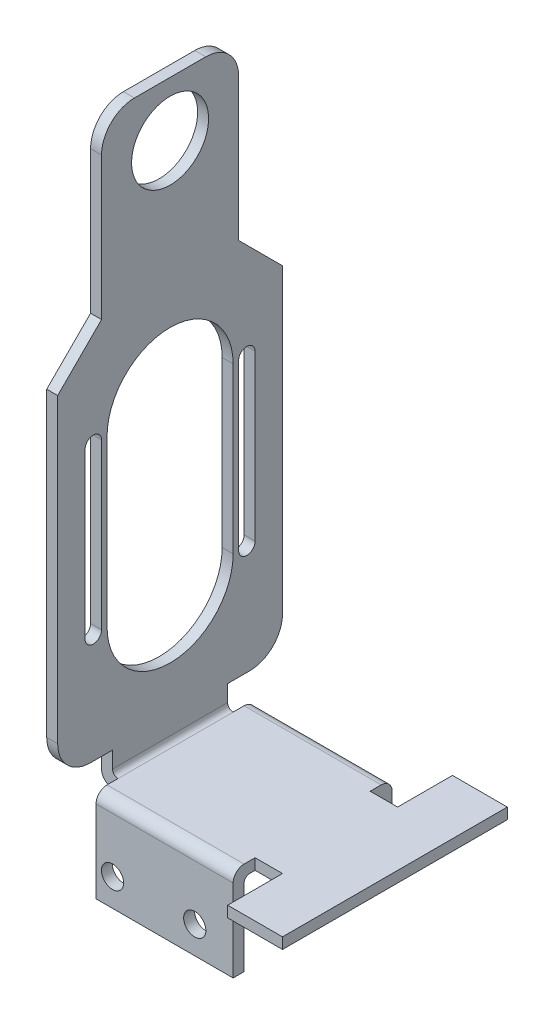
from build123d import *

# Parameters (mm, degrees)
SKETCH1_W                = 25
SKETCH1_H                = 25
BOSS_EXTRUDE1_DEPTH      = 2
BOSS_EXTRUDE2_DEPTH      = 15
BOSS_EXTRUDE2_DEPTH_BACK = 2
SKETCH2_W                = 25
SKETCH2_H                = 2
SKETCH3_R                = 2.025
CUT_EXTRUDE1_DEPTH       = 35.960692213
FILLET1_R                = 2
FILLET2_R                = 1
SKETCH4_W                = 21
SKETCH4_H                = 2
BOSS_EXTRUDE3_DEPTH      = 3
SKETCH5_W                = 21
SKETCH5_H                = 2
BOSS_EXTRUDE4_DEPTH      = 15
BOSS_EXTRUDE5_DEPTH      = 15
BOSS_EXTRUDE5_DEPTH_BACK = 36
SKETCH6_W                = 10
SKETCH6_H                = 2
SKETCH7_W                = 2
SKETCH7_H                = 41
BOSS_EXTRUDE6_DEPTH      = 105
SKETCH8_W                = 10
SKETCH8_H                = 4
CUT_EXTRUDE2_DEPTH       = 118.389309564
FILLET3_R                = 1
FILLET4_R                = 2
CUT_EXTRUDE3_DEPTH       = 119.102709537
SKETCH12_R               = 7.025
CUT_EXTRUDE4_DEPTH       = 119.102709537
CUT_EXTRUDE5_DEPTH       = 119.102709537
FILLET7_R                = 6
FILLET8_R                = 6
SKETCH14_W               = 10
SKETCH14_H               = 5
CUT_EXTRUDE6_DEPTH       = 112.496636721


with BuildPart() as part:
    # Sketch1 → Boss-Extrude1 (new body)
    with BuildSketch(Plane(origin=(0, 0, 0), x_dir=(1, 0, 0), z_dir=(0, 1, 0))):
        Rectangle(SKETCH1_W, SKETCH1_H)
    extrude(amount=BOSS_EXTRUDE1_DEPTH)

    # Sketch2 → Boss-Extrude2 (add, two sides: drawn at the far end of the back side and taken through both)
    with BuildSketch(Plane.XZ.offset(-BOSS_EXTRUDE2_DEPTH_BACK)):
        with Locations((0, 13.5)):
            Rectangle(SKETCH2_W, SKETCH2_H)
        with Locations((0, -13.5)):
            Rectangle(SKETCH2_W, SKETCH2_H)
    extrude(amount=BOSS_EXTRUDE2_DEPTH + BOSS_EXTRUDE2_DEPTH_BACK)

    # Sketch3 → Cut-Extrude1 (cut, through all)
    with BuildSketch(Plane.XY.offset(14.5)):
        with Locations((-9.5, -10)):
            Circle(SKETCH3_R)
        with Locations((5.5, -10)):
            Circle(SKETCH3_R)
    extrude(amount=-CUT_EXTRUDE1_DEPTH, mode=Mode.SUBTRACT)

    # Fillet1
    fillet1_edges = [part.edges().sort_by_distance(p)[0] for p in [
        (0, 2, 14.5),
        (0, 2, -14.5),
    ]]
    fillet(fillet1_edges, radius=FILLET1_R)

    # Fillet2
    fillet2_edges = [part.edges().sort_by_distance(p)[0] for p in [
        (0, 0, 12.5),
        (0, 0, -12.5),
    ]]
    fillet(fillet2_edges, radius=FILLET2_R)

    # Sketch4 → Boss-Extrude3 (add)
    with BuildSketch(Plane.ZY.offset(12.5)):
        with Locations((0, 1)):
            Rectangle(SKETCH4_W, SKETCH4_H)
    extrude(amount=BOSS_EXTRUDE3_DEPTH)

    # Sketch5 → Boss-Extrude4 (add)
    with BuildSketch(Plane(origin=(12.5, 0, 0), x_dir=(0, 0, -1), z_dir=(1, 0, 0))):
        with Locations((0, 1)):
            Rectangle(SKETCH5_W, SKETCH5_H)
    extrude(amount=BOSS_EXTRUDE4_DEPTH)

    # Sketch6 → Boss-Extrude5 (add, two sides: drawn at the far end of the back side and taken through both)
    with BuildSketch(Plane.XY.offset(10.5).offset(-BOSS_EXTRUDE5_DEPTH_BACK)):
        with Locations((22.5, 1)):
            Rectangle(SKETCH6_W, SKETCH6_H)
    extrude(amount=BOSS_EXTRUDE5_DEPTH + BOSS_EXTRUDE5_DEPTH_BACK)

    # Sketch7 → Boss-Extrude6 (add)
    with BuildSketch(Plane(origin=(0, 2, 0), x_dir=(1, 0, 0), z_dir=(0, 1, 0))):
        with Locations((-14.5, 0)):
            Rectangle(SKETCH7_W, SKETCH7_H)
    extrude(amount=BOSS_EXTRUDE6_DEPTH)

    # Sketch8 → Cut-Extrude2 (cut, through all)
    with BuildSketch(Plane(origin=(-13.5, 0, 0), x_dir=(0, 0, -1), z_dir=(1, 0, 0))):
        with Locations((-15.5, 4)):
            Rectangle(SKETCH8_W, SKETCH8_H)
        with Locations((15.5, 4)):
            Rectangle(SKETCH8_W, SKETCH8_H)
    extrude(amount=-CUT_EXTRUDE2_DEPTH, mode=Mode.SUBTRACT)

    # Fillet3
    fillet3_edges = [part.edges().sort_by_distance(p)[0] for p in [
        (-13.5, 2, 0),
    ]]
    fillet(fillet3_edges, radius=FILLET3_R)

    # Fillet4
    fillet4_edges = [part.edges().sort_by_distance(p)[0] for p in [
        (-15.5, 0, 0),
    ]]
    fillet(fillet4_edges, radius=FILLET4_R)

    # Sketch10 → Cut-Extrude3 (cut, through all)
    with BuildSketch(Plane.ZY.offset(15.5)):
        with BuildLine():
            Line((11.5, 56), (11.5, 26))
            ThreePointArc((11.5, 26), (0, 14.5), (-11.5, 26))
            Line((-11.5, 26), (-11.5, 56))
            ThreePointArc((-11.5, 56), (0, 67.5), (11.5, 56))
        make_face()
        with BuildLine():
            Line((-12.4975, 56), (-12.4975, 26))
            ThreePointArc((-12.4975, 26), (-14, 24.4975), (-15.5025, 26))
            Line((-15.5025, 26), (-15.5025, 56))
            ThreePointArc((-15.5025, 56), (-14, 57.5025), (-12.4975, 56))
        make_face()
        with BuildLine():
            Line((12.4975, 56), (12.4975, 26))
            ThreePointArc((12.4975, 26), (14, 24.4975), (15.5025, 26))
            Line((15.5025, 26), (15.5025, 56))
            ThreePointArc((15.5025, 56), (14, 57.5025), (12.4975, 56))
        make_face()
    extrude(amount=-CUT_EXTRUDE3_DEPTH, mode=Mode.SUBTRACT)

    # Sketch12 → Cut-Extrude4 (cut, through all)
    with BuildSketch(Plane.ZY.offset(15.5)):
        with Locations((0, 97)):
            Circle(SKETCH12_R)
    extrude(amount=-CUT_EXTRUDE4_DEPTH, mode=Mode.SUBTRACT)

    # Sketch13 → Cut-Extrude5 (cut, through all)
    with BuildSketch(Plane.ZY.offset(15.5)):
        Polygon((-20.5, 107), (-20.5, 67), (-12.5, 75), (-12.5, 107), align=None)
        Polygon((12.5, 75), (12.5, 107), (20.5, 107), (20.5, 67), align=None)
    extrude(amount=-CUT_EXTRUDE5_DEPTH, mode=Mode.SUBTRACT)

    # Fillet7
    fillet7_edges = [part.edges().sort_by_distance(p)[0] for p in [
        (-14.5, 107, 12.5),
        (-14.5, 107, -12.5),
    ]]
    fillet(fillet7_edges, radius=FILLET7_R)

    # Fillet8
    fillet8_edges = [part.edges().sort_by_distance(p)[0] for p in [
        (-14.5, 6, 20.5),
        (-14.5, 6, -20.5),
    ]]
    fillet(fillet8_edges, radius=FILLET8_R)

    # Sketch14 → Cut-Extrude6 (cut, through all)
    with BuildSketch(Plane(origin=(0, 2, 0), x_dir=(1, 0, 0), z_dir=(0, 1, 0))):
        with Locations((22.5, 23)):
            Rectangle(SKETCH14_W, SKETCH14_H)
        with Locations((22.5, -23)):
            Rectangle(SKETCH14_W, SKETCH14_H)
    extrude(amount=-CUT_EXTRUDE6_DEPTH, mode=Mode.SUBTRACT)


solid = part.part
